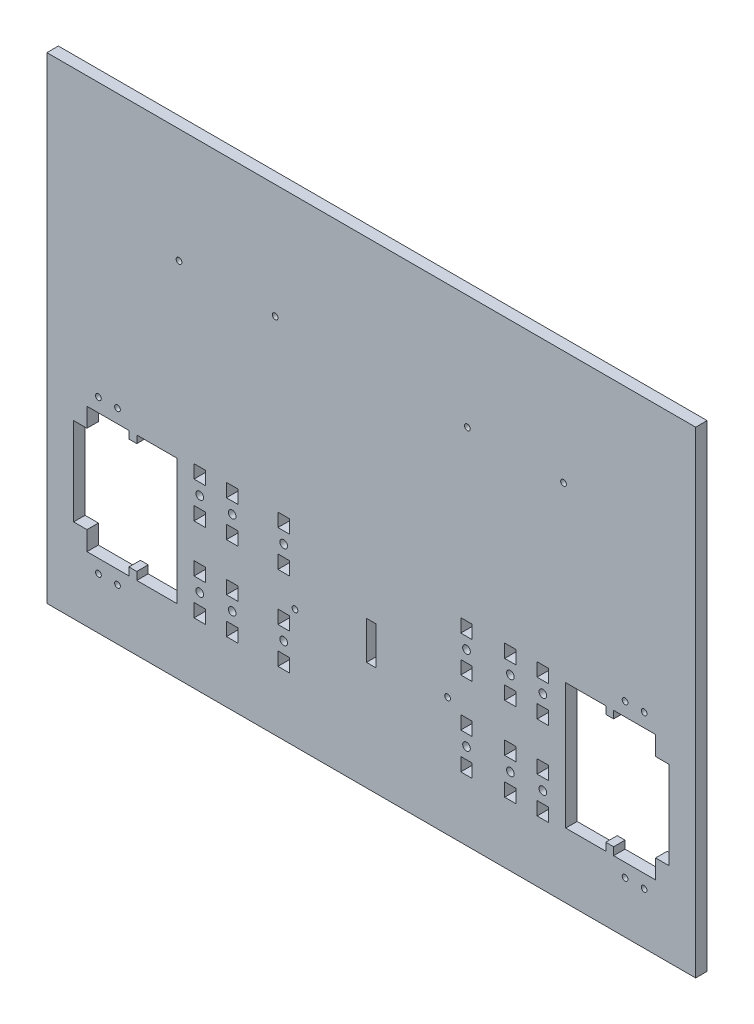
from build123d import *

# Parameters (mm, degrees)
ESQUISSE1_W             = 340
ESQUISSE1_H             = 250
BOSS_EXTRU_1_DEPTH      = 6
ESQUISSE10_R            = 2
ESQUISSE10_W            = 6
ESQUISSE10_H            = 7
ESQUISSE10_W_2          = 5
ESQUISSE10_H_2          = 20
ESQUISSE10_W_3          = 21
ESQUISSE10_H_3          = 66
ENL_V_MAT_EXTRU_5_DEPTH = 6
ESQUISSE13_R            = 1.5
ENL_V_MAT_EXTRU_6_DEPTH = 6


with BuildPart() as part:
    # Esquisse1 → Boss.-Extru.1 (new body)
    with BuildSketch(Plane.XY):
        with Locations((-170, 125)):
            Rectangle(ESQUISSE1_W, ESQUISSE1_H)
    extrude(amount=-BOSS_EXTRU_1_DEPTH)

    # Esquisse10 → Enlèv. mat.-Extru.5 (cut)
    with BuildSketch(Plane(origin=(0, 0, -6), x_dir=(-1, 0, 0), z_dir=(0, 0, -1))):
        with Locations((259.9, 45)):
            Circle(ESQUISSE10_R)
        with Locations((259.9, 89)):
            Circle(ESQUISSE10_R)
        with Locations((242.9, 45)):
            Circle(ESQUISSE10_R)
        with Locations((242.9, 89)):
            Circle(ESQUISSE10_R)
        with Locations((215.9, 45)):
            Circle(ESQUISSE10_R)
        with Locations((215.9, 89)):
            Circle(ESQUISSE10_R)
        with Locations(Location((97.1, 89, 0), (0, 0, 180))):
            Circle(ESQUISSE10_R)
        with Locations(Location((97.1, 45, 0), (0, 0, 180))):
            Circle(ESQUISSE10_R)
        with Locations(Location((80.1, 89, 0), (0, 0, 180))):
            Circle(ESQUISSE10_R)
        with Locations(Location((120.1, 89, 0), (0, 0, 180))):
            Circle(ESQUISSE10_R)
        with Locations(Location((120.1, 45, 0), (0, 0, 180))):
            Circle(ESQUISSE10_R)
        with Locations(Location((80.1, 45, 0), (0, 0, 180))):
            Circle(ESQUISSE10_R)
        with Locations((259.9, 35.5)):
            Rectangle(ESQUISSE10_W, ESQUISSE10_H)
        with Locations((259.9, 54.5)):
            Rectangle(ESQUISSE10_W, ESQUISSE10_H)
        with Locations((259.9, 79.5)):
            Rectangle(ESQUISSE10_W, ESQUISSE10_H)
        with Locations((259.9, 98.5)):
            Rectangle(ESQUISSE10_W, ESQUISSE10_H)
        with Locations((242.9, 35.5)):
            Rectangle(ESQUISSE10_W, ESQUISSE10_H)
        with Locations((170, 67)):
            Rectangle(ESQUISSE10_W_2, ESQUISSE10_H_2)
        with Locations((242.9, 54.5)):
            Rectangle(ESQUISSE10_W, ESQUISSE10_H)
        with Locations((242.9, 79.5)):
            Rectangle(ESQUISSE10_W, ESQUISSE10_H)
        with Locations((242.9, 98.5)):
            Rectangle(ESQUISSE10_W, ESQUISSE10_H)
        with Locations((215.9, 35.5)):
            Rectangle(ESQUISSE10_W, ESQUISSE10_H)
        with Locations((215.9, 54.5)):
            Rectangle(ESQUISSE10_W, ESQUISSE10_H)
        with Locations((215.9, 79.5)):
            Rectangle(ESQUISSE10_W, ESQUISSE10_H)
        with Locations((215.9, 98.5)):
            Rectangle(ESQUISSE10_W, ESQUISSE10_H)
        with Locations((97.1, 98.5)):
            Rectangle(ESQUISSE10_W, ESQUISSE10_H)
        with Locations((97.1, 79.5)):
            Rectangle(ESQUISSE10_W, ESQUISSE10_H)
        with Locations((97.1, 54.5)):
            Rectangle(ESQUISSE10_W, ESQUISSE10_H)
        with Locations((97.1, 35.5)):
            Rectangle(ESQUISSE10_W, ESQUISSE10_H)
        with Locations((80.1, 98.5)):
            Rectangle(ESQUISSE10_W, ESQUISSE10_H)
        with Locations((80.1, 79.5)):
            Rectangle(ESQUISSE10_W, ESQUISSE10_H)
        with Locations((120.1, 98.5)):
            Rectangle(ESQUISSE10_W, ESQUISSE10_H)
        with Locations((120.1, 79.5)):
            Rectangle(ESQUISSE10_W, ESQUISSE10_H)
        with Locations((80.1, 54.5)):
            Rectangle(ESQUISSE10_W, ESQUISSE10_H)
        with Locations((120.1, 54.5)):
            Rectangle(ESQUISSE10_W, ESQUISSE10_H)
        with Locations((120.1, 35.5)):
            Rectangle(ESQUISSE10_W, ESQUISSE10_H)
        with Locations((80.1, 35.5)):
            Rectangle(ESQUISSE10_W, ESQUISSE10_H)
        with Locations((282.4, 67)):
            Rectangle(ESQUISSE10_W_3, ESQUISSE10_H_3)
        with Locations((57.6, 67)):
            Rectangle(ESQUISSE10_W_3, ESQUISSE10_H_3)
    extrude(amount=-ENL_V_MAT_EXTRU_5_DEPTH, mode=Mode.SUBTRACT)

    # Esquisse13 → Enlèv. mat.-Extru.6 (cut)
    with BuildSketch(Plane(origin=(0, 0, -6), x_dir=(-1, 0, 0), z_dir=(0, 0, -1))):
        with Locations((69.249793531, 190.11516604)):
            Circle(ESQUISSE13_R)
        with Locations((119.624896765, 190.11516604)):
            Circle(ESQUISSE13_R)
        with Locations(Location((220.375103235, 190.11516604, 0), (0, 0, 180))):
            Circle(ESQUISSE13_R)
        with Locations(Location((270.750206469, 190.11516604, 0), (0, 0, 180))):
            Circle(ESQUISSE13_R)
        with Locations((27, 27)):
            Circle(ESQUISSE13_R)
        with Locations((130, 62.4)):
            Circle(ESQUISSE13_R)
        with Locations(Location((210, 62.4, 0), (0, 0, 180))):
            Circle(ESQUISSE13_R)
        with Locations((37, 27)):
            Circle(ESQUISSE13_R)
        with Locations(Location((37, 107.148940914, 0), (0, 0, 180))):
            Circle(ESQUISSE13_R)
        with Locations(Location((27, 107.148940914, 0), (0, 0, 180))):
            Circle(ESQUISSE13_R)
        with Locations(Location((303, 27, 0), (0, 0, 180))):
            Circle(ESQUISSE13_R)
        with Locations(Location((313, 27, 0), (0, 0, 180))):
            Circle(ESQUISSE13_R)
        with Locations((313, 107.148940914)):
            Circle(ESQUISSE13_R)
        with Locations((303, 107.148940914)):
            Circle(ESQUISSE13_R)
        Polygon((43, 100), (21, 100), (21, 90), (14, 90), (14, 44), (21, 44), (21, 34), (43, 34), (43, 38.074470457), (47.1, 38.074470457), (47.1, 96.074470457), (43, 96.074470457), align=None)
        Polygon((297, 38.074470457), (297, 34), (319, 34), (319, 44), (326, 44), (326, 90), (319, 90), (319, 100), (297, 100), (297, 96.074470457), (292.9, 96.074470457), (292.9, 38.074470457), align=None)
    extrude(amount=-ENL_V_MAT_EXTRU_6_DEPTH, mode=Mode.SUBTRACT)


solid = part.part
